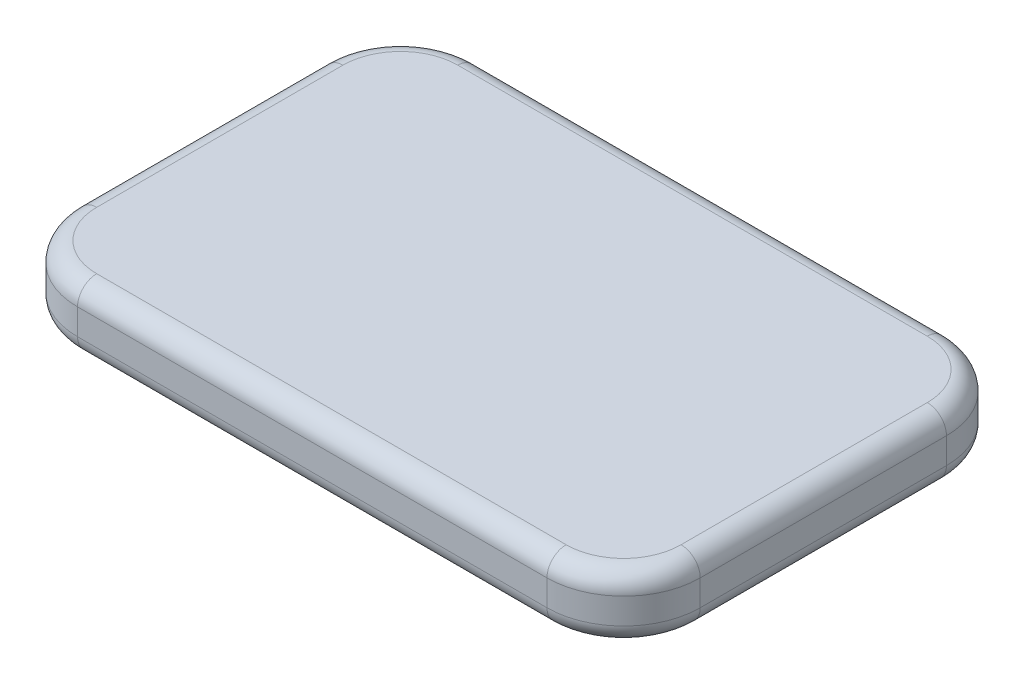
from build123d import *

# Parameters (mm, degrees)
SKETCH2_W           = 165.1
SKETCH2_H           = 105.918
BOSS_EXTRUDE1_DEPTH = 17.018
FILLET1_R           = 20.32
FILLET2_R           = 5.08
FILLET3_R           = 5.08


with BuildPart() as part:
    # Sketch2 → Boss-Extrude1 (new body)
    with BuildSketch(Plane(origin=(0, 0, 0), x_dir=(1, 0, 0), z_dir=(0, 1, 0))):
        with Locations((82.55, 52.959)):
            Rectangle(SKETCH2_W, SKETCH2_H)
    extrude(amount=BOSS_EXTRUDE1_DEPTH)

    # Fillet1
    fillet1_edges = [part.edges().sort_by_distance(p)[0] for p in [
        (0, 8.509, -105.918),
        (0, 8.509, 0),
        (165.1, 8.509, 0),
        (165.1, 8.509, -105.918),
    ]]
    fillet(fillet1_edges, radius=FILLET1_R)

    # Fillet2
    fillet2_edges = [part.edges().sort_by_distance(p)[0] for p in [
        (165.1, 17.018, -52.959),
        (82.55, 17.018, 0),
        (82.55, 17.018, -105.918),
        (0, 17.018, -52.959),
        (5.951590206, 17.018, -5.951590206),
        (5.951590206, 17.018, -99.966409794),
        (159.148409794, 17.018, -99.966409794),
        (159.148409794, 17.018, -5.951590206),
    ]]
    fillet(fillet2_edges, radius=FILLET2_R)

    # Fillet3
    fillet3_edges = [part.edges().sort_by_distance(p)[0] for p in [
        (165.1, 0, -52.959),
        (82.55, 0, -105.918),
        (82.55, 0, 0),
        (0, 0, -52.959),
        (5.951590206, 0, -5.951590206),
        (5.951590206, 0, -99.966409794),
        (159.148409794, 0, -99.966409794),
        (159.148409794, 0, -5.951590206),
    ]]
    fillet(fillet3_edges, radius=FILLET3_R)


solid = part.part
